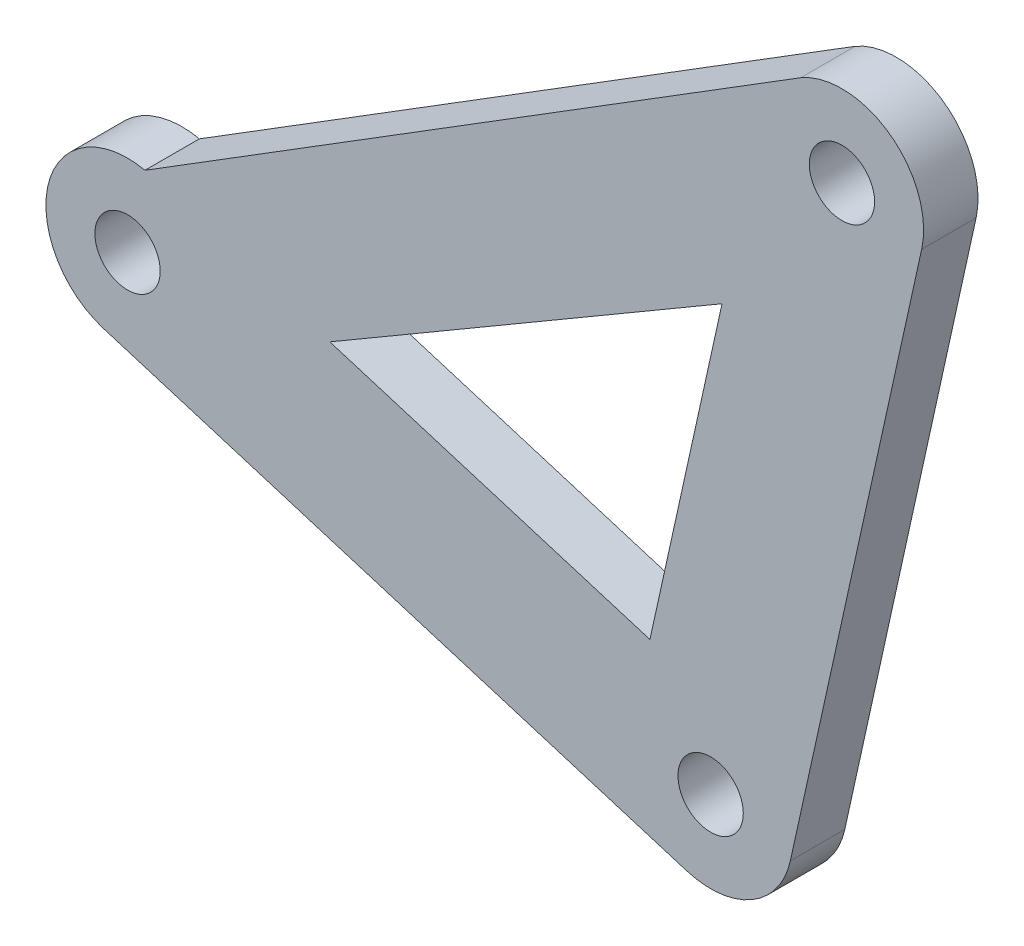
from build123d import *

# Parameters (mm, degrees)
BOSS_EXTRU_1_DEPTH           = 5
ENL_V_MAT_EXTRU_1_DEPTH      = 139.023902146
ENL_V_MAT_EXTRU_1_DEPTH_BACK = 139.023902146
ESQUISSE2_R                  = 3


with BuildPart() as part:
    # Esquisse1 → Boss.-Extru.1 (new body)
    with BuildSketch(Plane.XY):
        with BuildLine():
            Line((-56.676061624, -5.615526744), (-44.613461935, 49.069879799))
            ThreePointArc((-44.613461935, 49.069879799), (-47.521267958, 56.747400855), (-55.720555636, 57.161341672))
            Line((-55.720555636, 57.161341672), (-115.960936395, 19.676937291))
            ThreePointArc((-115.960936395, 19.676937291), (-124.816589866, 14.245466781), (-119.749865766, 5.176190229))
            Line((-119.749865766, 5.176190229), (-66.18965615, -11.173242359))
            ThreePointArc((-66.18965615, -11.173242359), (-60.216844676, -10.475935129), (-56.676061624, -5.615526744))
        make_face()
        Polygon((-62.953169806, 35.564136013), (-69.575176268, 5.543483348), (-98.978129472, 14.518832861), align=None, mode=Mode.SUBTRACT)
    extrude(amount=-BOSS_EXTRU_1_DEPTH)

    # Esquisse2 → Enlèv. mat.-Extru.1 (cut, two sides: drawn at the far end of the back side and taken through both)
    with BuildSketch(Plane.XY.offset(-ENL_V_MAT_EXTRU_1_DEPTH_BACK)):
        with Locations((-117.560209615, 12.349432588)):
            Circle(ESQUISSE2_R)
        with Locations((-64, -4)):
            Circle(ESQUISSE2_R)
        with Locations((-51.937400312, 50.685406543)):
            Circle(ESQUISSE2_R)
    extrude(amount=ENL_V_MAT_EXTRU_1_DEPTH + ENL_V_MAT_EXTRU_1_DEPTH_BACK, mode=Mode.SUBTRACT)


solid = part.part
